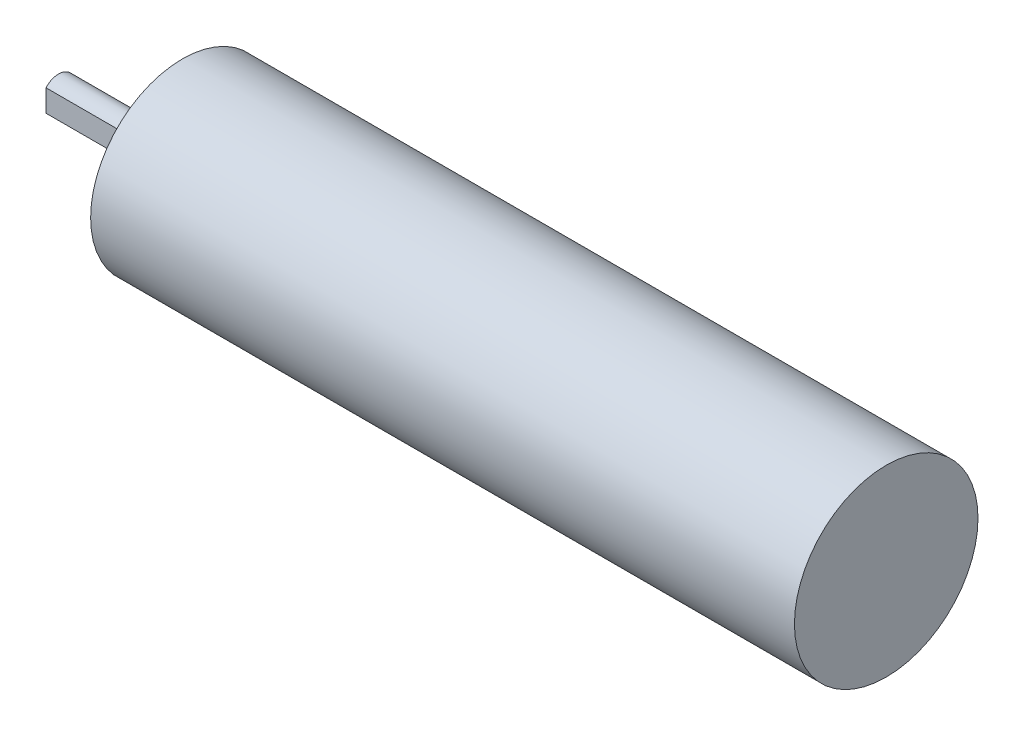
from build123d import *

# Parameters (mm, degrees)
SKETCH1_W           = 52.6
SKETCH1_H           = 11
SKETCH2_R           = 5
BOSS_EXTRUDE1_DEPTH = 1.35
SKETCH3_R           = 3.5
BOSS_EXTRUDE2_DEPTH = 1.8
SKETCH4_R           = 2
BOSS_EXTRUDE3_DEPTH = 11.7
CUT_EXTRUDE1_REACH  = 71.221
HOLE1_D             = 1.95
HOLE1_DEPTH         = 6.5
HOLE2_D             = 1.95
HOLE2_DEPTH         = 6.5
HOLE3_D             = 1.95
HOLE3_DEPTH         = 6.5
HOLE4_D             = 7
HOLE4_DEPTH         = 6.4
HOLE5_D             = 2.1
HOLE5_DEPTH         = 3
HOLE6_D             = 2.1
HOLE6_DEPTH         = 3
HOLE7_D             = 2.1
HOLE7_DEPTH         = 3
SKETCH25_R          = 11
BOSS_EXTRUDE4_DEPTH = 31.75


with BuildPart() as part:
    # Sketch1 → Revolve1 (revolve)
    with BuildSketch(Plane.XY, mode=Mode.PRIVATE) as revolve1_sk:
        with Locations((26.3, 5.5)):
            Rectangle(SKETCH1_W, SKETCH1_H)
    revolve(revolve1_sk.sketch.rotate(Axis((0, 0, 0), (1, 0, 0)), 270), axis=Axis((0, 0, 0), (1, 0, 0)))

    # Sketch2 → Boss-Extrude1 (add)
    with BuildSketch(Plane.ZY):
        with Locations(Location((0, 0, 0), (0, 0, 180))):
            Circle(SKETCH2_R)
    extrude(amount=BOSS_EXTRUDE1_DEPTH)

    # Sketch3 → Boss-Extrude2 (add)
    with BuildSketch(Plane.ZY.offset(1.35)):
        Circle(SKETCH3_R)
    extrude(amount=BOSS_EXTRUDE2_DEPTH)

    # Sketch4 → Boss-Extrude3 (add)
    with BuildSketch(Plane.ZY.offset(3.15)):
        Circle(SKETCH4_R)
    extrude(amount=BOSS_EXTRUDE3_DEPTH)

    # Cut-Extrude1: up to this plane
    cut_extrude1_end = Plane(origin=(-3.675, 0, 3.675), z_dir=(0.707106781186547, 0, -0.707106781186548))
    # Sketch6 → Cut-Extrude1 (cut, up to the surface)
    with BuildSketch(Plane.ZY.offset(14.85), mode=Mode.PRIVATE) as cut_extrude1_sk1:
        with BuildLine():
            Line((1.5, 1.322875656), (1.5, -1.322875656))
            ThreePointArc((1.5, -1.322875656), (2, 0), (1.5, 1.322875656))
        make_face()
    cut_extrude1_tool1 = split(extrude(cut_extrude1_sk1.sketch, amount=-CUT_EXTRUDE1_REACH, mode=Mode.PRIVATE), bisect_by=cut_extrude1_end, keep=Keep.BOTH, mode=Mode.PRIVATE)
    add(cut_extrude1_tool1.solids().sort_by_distance((-14.85, 0, 1.702311))[0], mode=Mode.SUBTRACT)

    # Hole1
    with Locations(Plane.ZY):
        with Locations((7, 0)):
            Hole(HOLE1_D / 2, depth=HOLE1_DEPTH)

    # Hole2
    with Locations(Plane.ZY):
        with Locations((-3.5, -6.062177826)):
            Hole(HOLE2_D / 2, depth=HOLE2_DEPTH)

    # Hole3
    with Locations(Plane.ZY):
        with Locations((-3.5, 6.062177826)):
            Hole(HOLE3_D / 2, depth=HOLE3_DEPTH)

    # Hole4
    with Locations(Plane(origin=(52.6, 0, 0), x_dir=(0, 0, -1), z_dir=(1, 0, 0))):
        with Locations((0, 0)):
            Hole(HOLE4_D / 2, depth=HOLE4_DEPTH)

    # Hole5
    with Locations(Plane(origin=(52.6, 0, 0), x_dir=(0, 0, -1), z_dir=(1, 0, 0))):
        with Locations((-8.5, 0)):
            Hole(HOLE5_D / 2, depth=HOLE5_DEPTH)

    # Hole6
    with Locations(Plane(origin=(52.6, 0, 0), x_dir=(0, 0, -1), z_dir=(1, 0, 0))):
        with Locations((4.25, -7.361215932)):
            Hole(HOLE6_D / 2, depth=HOLE6_DEPTH)

    # Hole7
    with Locations(Plane(origin=(52.6, 0, 0), x_dir=(0, 0, -1), z_dir=(1, 0, 0))):
        with Locations((4.25, 7.361215932)):
            Hole(HOLE7_D / 2, depth=HOLE7_DEPTH)

    # Sketch25 → Boss-Extrude4 (add)
    with BuildSketch(Plane(origin=(52.6, 0, 0), x_dir=(0, 0, -1), z_dir=(1, 0, 0))):
        Circle(SKETCH25_R)
    extrude(amount=BOSS_EXTRUDE4_DEPTH)


solid = part.part
